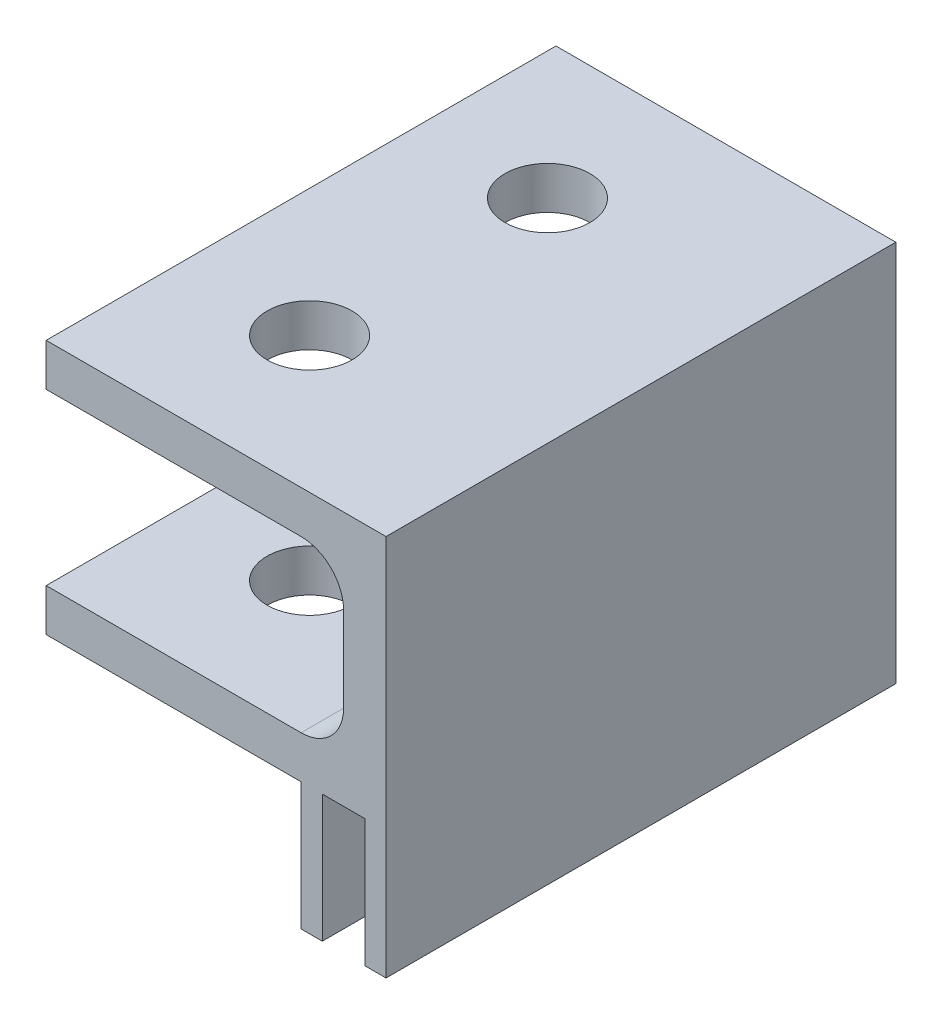
from build123d import *

# Parameters (mm, degrees)
BOSS_EXTRUDE1_DEPTH = 60
FILLET1_R           = 5
SKETCH2_R           = 5
CUT_EXTRUDE1_DEPTH  = 75
SKETCH3_W           = 2.5
SKETCH3_H           = 60
BOSS_EXTRUDE2_DEPTH = 15


with BuildPart() as part:
    # Sketch1 → Boss-Extrude1 (new body)
    with BuildSketch(Plane.XY):
        Polygon((0, 0), (35, 0), (35, -20), (0, -20), (0, -25), (40, -25), (40, 5), (0, 5), align=None)
    extrude(amount=BOSS_EXTRUDE1_DEPTH)

    # Fillet1
    fillet1_edges = [part.edges().sort_by_distance(p)[0] for p in [
        (35, -20, 30),
        (35, 0, 30),
    ]]
    fillet(fillet1_edges, radius=FILLET1_R)

    # Sketch2 → Cut-Extrude1 (cut)
    with BuildSketch(Plane(origin=(0, 5, 0), x_dir=(1, 0, 0), z_dir=(0, 1, 0))):
        with Locations(Location((15, -44, 0), (0, 0, 180))):
            Circle(SKETCH2_R)
        with Locations(Location((15, -16, 0), (0, 0, 270))):
            Circle(SKETCH2_R)
    extrude(amount=-CUT_EXTRUDE1_DEPTH, mode=Mode.SUBTRACT)

    # Sketch3 → Boss-Extrude2 (add)
    with BuildSketch(Plane.XZ.offset(25)):
        with Locations((31.25, 30)):
            Rectangle(SKETCH3_W, SKETCH3_H)
        with Locations((38.75, 30)):
            Rectangle(SKETCH3_W, SKETCH3_H)
    extrude(amount=BOSS_EXTRUDE2_DEPTH)


solid = part.part
